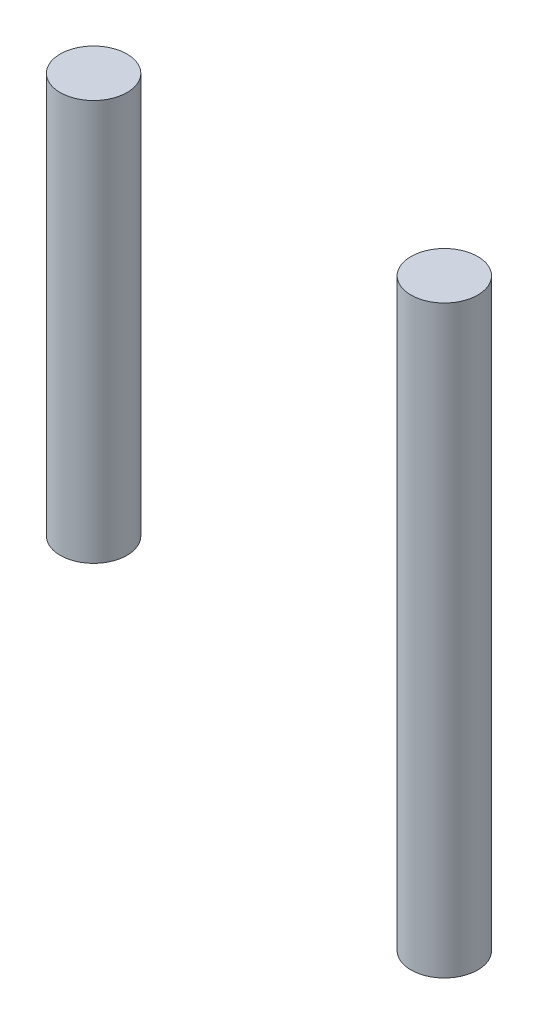
from build123d import *

# Parameters (mm, degrees)
SKETCH1_R           = 2
BOSS_EXTRUDE1_DEPTH = 24
SKETCH2_R           = 2
BOSS_EXTRUDE2_DEPTH = 35


with BuildPart() as part:
    # Sketch1 → Boss-Extrude1 (new body)
    with BuildSketch(Plane(origin=(0, -120.5, 0), x_dir=(1, 0, 0), z_dir=(0, 1, 0))):
        with Locations(Location((-10.5, -26, 0), (0, 0, 270))):
            Circle(SKETCH1_R)
    extrude(amount=BOSS_EXTRUDE1_DEPTH)


with BuildPart() as body_2:
    # Sketch2 → Boss-Extrude2 (new body)
    with BuildSketch(Plane(origin=(0, -131.5, 0), x_dir=(1, 0, 0), z_dir=(0, 1, 0))):
        with Locations(Location((10.5, -26, 0), (0, 0, 270))):
            Circle(SKETCH2_R)
    extrude(amount=BOSS_EXTRUDE2_DEPTH)


solid = Compound([part.part, body_2.part])
